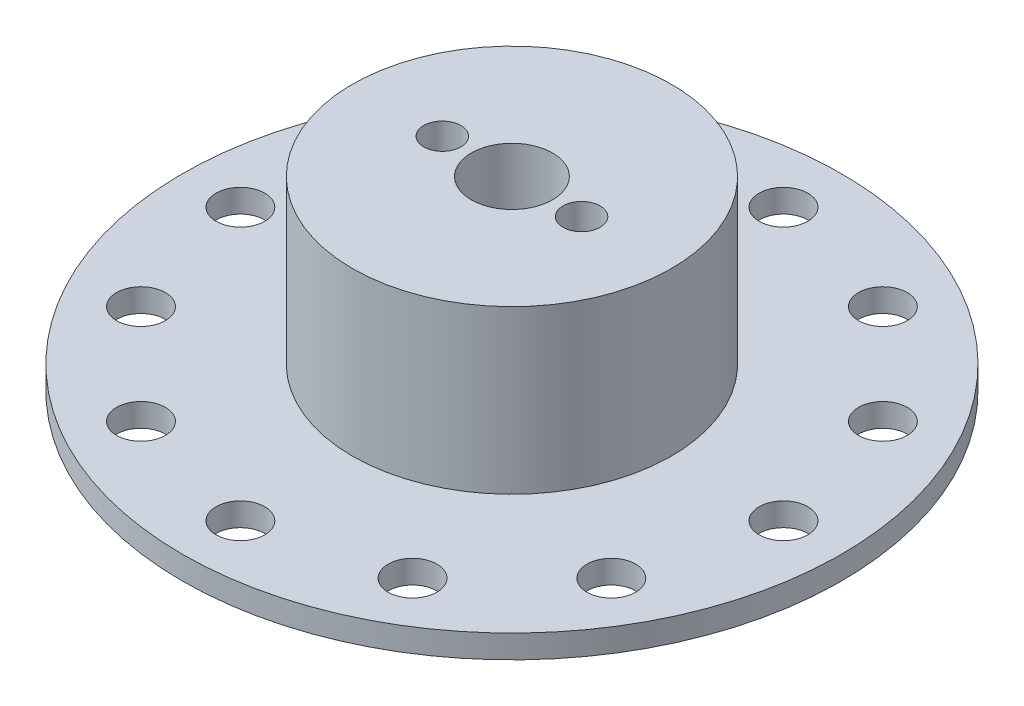
from build123d import *

# Parameters (mm, degrees)
SKETCH_1_R          = 28.4
EXTRUDE_1_DEPTH     = 2
SKETCH_2_R          = 13.75
EXTRUDE_2_DEPTH     = 14
SKETCH_3_R          = 3.5
SKETCH_3_R_2        = 1.6
CUT_EXTRUDE_1_DEPTH = 44.233320483
SKETCH_4_R          = 2.1
CUT_EXTRUDE_2_DEPTH = 43.533751304


with BuildPart() as part:
    # ｽｹｯﾁ1 → ﾎﾞｽ - 押し出し1 (new body)
    with BuildSketch(Plane(origin=(0, 0, 0), x_dir=(1, 0, 0), z_dir=(0, 1, 0))):
        with Locations(Location((0, 0, 0), (0, 0, 270))):
            Circle(SKETCH_1_R)
    extrude(amount=EXTRUDE_1_DEPTH)

    # ｽｹｯﾁ2 → ﾎﾞｽ - 押し出し2 (add)
    with BuildSketch(Plane(origin=(0, 2, 0), x_dir=(1, 0, 0), z_dir=(0, 1, 0))):
        with Locations(Location((0, 0, 0), (0, 0, 270))):
            Circle(SKETCH_2_R)
    extrude(amount=EXTRUDE_2_DEPTH)

    # ｽｹｯﾁ3 → ｶｯﾄ - 押し出し1 (cut, through all)
    with BuildSketch(Plane(origin=(0, 16, 0), x_dir=(1, 0, 0), z_dir=(0, 1, 0))):
        with Locations(Location((0, 0, 0), (0, 0, 270))):
            Circle(SKETCH_3_R)
        with Locations(Location((-6, 0, 0), (0, 0, 270))):
            Circle(SKETCH_3_R_2)
        with Locations(Location((6, 0, 0), (0, 0, 270))):
            Circle(SKETCH_3_R_2)
    extrude(amount=-CUT_EXTRUDE_1_DEPTH, mode=Mode.SUBTRACT)

    # ｽｹｯﾁ4 → ｶｯﾄ - 押し出し2 (cut, through all)
    with BuildSketch(Plane(origin=(0, 2, 0), x_dir=(1, 0, 0), z_dir=(0, 1, 0))):
        with Locations(Location((0, 23.4, 0), (0, 0, 270))):
            Circle(SKETCH_4_R)
        with Locations(Location((11.7, 20.264994449, 0), (0, 0, 270))):
            Circle(SKETCH_4_R)
        with Locations(Location((20.264994449, 11.7, 0), (0, 0, 270))):
            Circle(SKETCH_4_R)
        with Locations(Location((23.4, 0, 0), (0, 0, 270))):
            Circle(SKETCH_4_R)
        with Locations(Location((20.264994449, -11.7, 0), (0, 0, 270))):
            Circle(SKETCH_4_R)
        with Locations(Location((11.7, -20.264994449, 0), (0, 0, 270))):
            Circle(SKETCH_4_R)
        with Locations(Location((0, -23.4, 0), (0, 0, 270))):
            Circle(SKETCH_4_R)
        with Locations(Location((-11.7, -20.264994449, 0), (0, 0, 270))):
            Circle(SKETCH_4_R)
        with Locations(Location((-20.264994449, -11.7, 0), (0, 0, 270))):
            Circle(SKETCH_4_R)
        with Locations(Location((-23.4, 0, 0), (0, 0, 270))):
            Circle(SKETCH_4_R)
        with Locations(Location((-20.264994449, 11.7, 0), (0, 0, 270))):
            Circle(SKETCH_4_R)
        with Locations(Location((-11.7, 20.264994449, 0), (0, 0, 270))):
            Circle(SKETCH_4_R)
    extrude(amount=-CUT_EXTRUDE_2_DEPTH, mode=Mode.SUBTRACT)


solid = part.part
